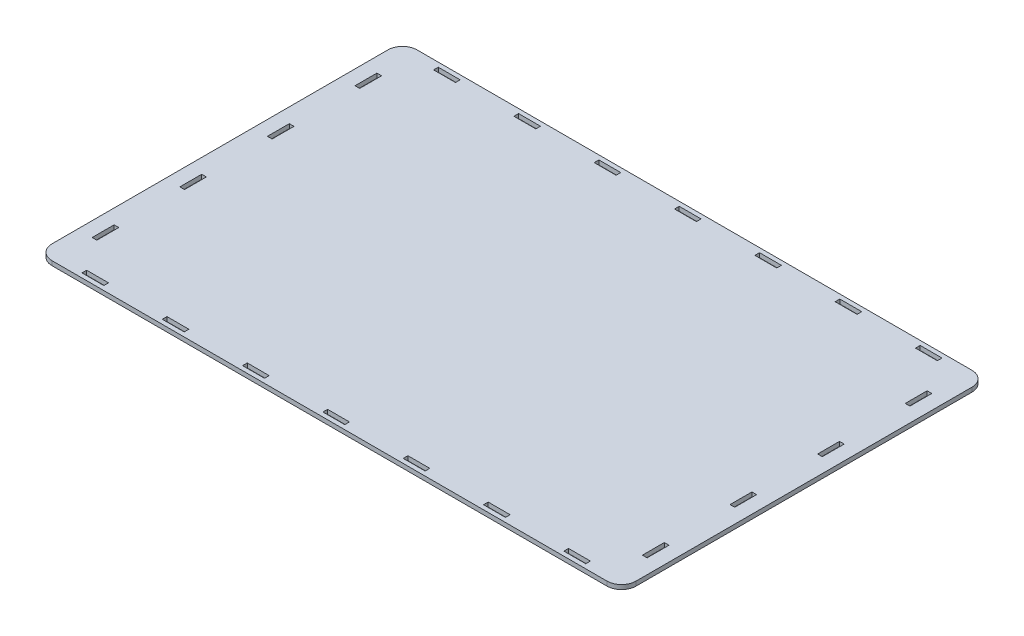
from build123d import *

# Parameters (mm, degrees)
SKETCH1_W           = 400
SKETCH1_H           = 250
SKETCH1_W_2         = 15
SKETCH1_H_2         = 3.2
SKETCH1_W_3         = 3.2
SKETCH1_H_3         = 15
BOSS_EXTRUDE2_DEPTH = 3
FILLET1_R           = 10


with BuildPart() as part:
    # Sketch1 → Boss-Extrude2 (new body)
    with BuildSketch(Plane(origin=(0, 0, 0), x_dir=(1, 0, 0), z_dir=(0, 1, 0))):
        with Locations((200, 125)):
            Rectangle(SKETCH1_W, SKETCH1_H)
        with Locations((90, 4.6)):
            Rectangle(SKETCH1_W_2, SKETCH1_H_2, mode=Mode.SUBTRACT)
        with Locations((35, 4.6)):
            Rectangle(SKETCH1_W_2, SKETCH1_H_2, mode=Mode.SUBTRACT)
        with Locations((145, 4.6)):
            Rectangle(SKETCH1_W_2, SKETCH1_H_2, mode=Mode.SUBTRACT)
        with Locations((200, 4.6)):
            Rectangle(SKETCH1_W_2, SKETCH1_H_2, mode=Mode.SUBTRACT)
        with Locations((255, 4.6)):
            Rectangle(SKETCH1_W_2, SKETCH1_H_2, mode=Mode.SUBTRACT)
        with Locations((310, 4.6)):
            Rectangle(SKETCH1_W_2, SKETCH1_H_2, mode=Mode.SUBTRACT)
        with Locations((365, 4.6)):
            Rectangle(SKETCH1_W_2, SKETCH1_H_2, mode=Mode.SUBTRACT)
        with Locations((365, 245.4)):
            Rectangle(SKETCH1_W_2, SKETCH1_H_2, mode=Mode.SUBTRACT)
        with Locations((310, 245.4)):
            Rectangle(SKETCH1_W_2, SKETCH1_H_2, mode=Mode.SUBTRACT)
        with Locations((255, 245.4)):
            Rectangle(SKETCH1_W_2, SKETCH1_H_2, mode=Mode.SUBTRACT)
        with Locations((200, 245.4)):
            Rectangle(SKETCH1_W_2, SKETCH1_H_2, mode=Mode.SUBTRACT)
        with Locations((35, 245.4)):
            Rectangle(SKETCH1_W_2, SKETCH1_H_2, mode=Mode.SUBTRACT)
        with Locations((90, 245.4)):
            Rectangle(SKETCH1_W_2, SKETCH1_H_2, mode=Mode.SUBTRACT)
        with Locations((145, 245.4)):
            Rectangle(SKETCH1_W_2, SKETCH1_H_2, mode=Mode.SUBTRACT)
        with Locations((11.6, 95)):
            Rectangle(SKETCH1_W_3, SKETCH1_H_3, mode=Mode.SUBTRACT)
        with Locations((11.6, 35)):
            Rectangle(SKETCH1_W_3, SKETCH1_H_3, mode=Mode.SUBTRACT)
        with Locations((11.6, 155)):
            Rectangle(SKETCH1_W_3, SKETCH1_H_3, mode=Mode.SUBTRACT)
        with Locations((11.6, 215)):
            Rectangle(SKETCH1_W_3, SKETCH1_H_3, mode=Mode.SUBTRACT)
        with Locations((388.4, 35)):
            Rectangle(SKETCH1_W_3, SKETCH1_H_3, mode=Mode.SUBTRACT)
        with Locations((388.4, 95)):
            Rectangle(SKETCH1_W_3, SKETCH1_H_3, mode=Mode.SUBTRACT)
        with Locations((388.4, 155)):
            Rectangle(SKETCH1_W_3, SKETCH1_H_3, mode=Mode.SUBTRACT)
        with Locations((388.4, 215)):
            Rectangle(SKETCH1_W_3, SKETCH1_H_3, mode=Mode.SUBTRACT)
    extrude(amount=BOSS_EXTRUDE2_DEPTH)

    # Fillet1
    fillet1_edges = [part.edges().sort_by_distance(p)[0] for p in [
        (0, 1.5, -250),
        (400, 1.5, -250),
        (400, 1.5, 0),
        (0, 1.5, 0),
    ]]
    fillet(fillet1_edges, radius=FILLET1_R)


solid = part.part
